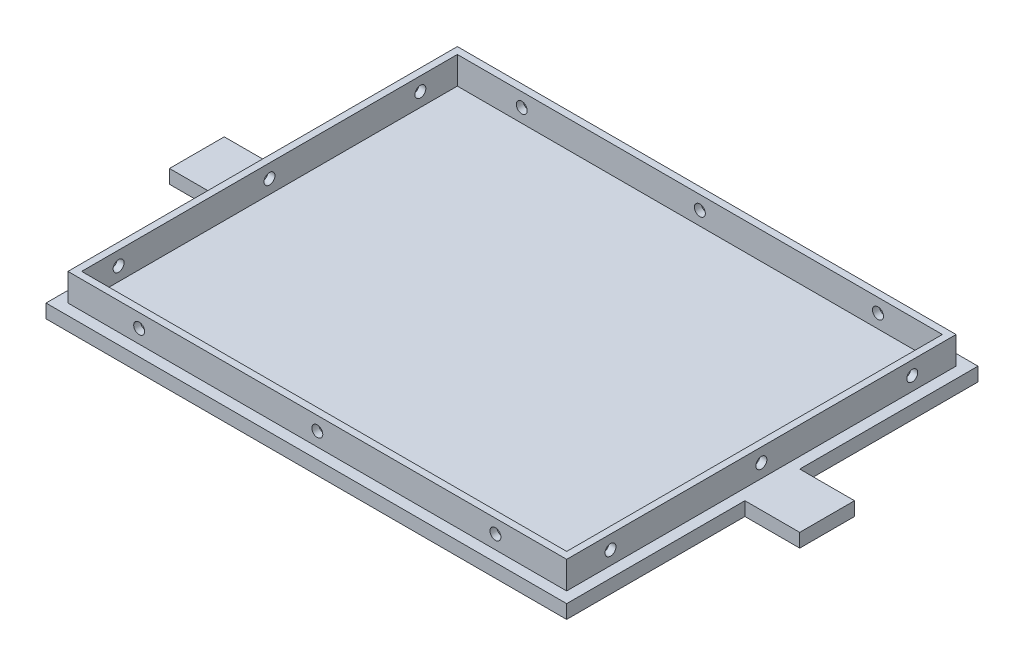
from build123d import *

# Parameters (mm, degrees)
BOSS_EXTRUDE1_DEPTH = 5
SKETCH3_W           = 182
SKETCH3_H           = 142.11
SKETCH3_W_2         = 177
SKETCH3_H_2         = 137.11
BOSS_EXTRUDE2_DEPTH = 10
SKETCH6_R           = 2
CUT_EXTRUDE3_DEPTH  = 211
SKETCH8_R           = 2
CUT_EXTRUDE4_DEPTH  = 211


with BuildPart() as part:
    # Sketch1 → Boss-Extrude1 (new body)
    with BuildSketch(Plane(origin=(0, 0, 0), x_dir=(1, 0, 0), z_dir=(0, 1, 0))):
        Polygon((-95, 75.055), (95, 75.055), (95, 10), (115, 10), (115, -10), (95, -10), (95, -75.055), (-95, -75.055), (-95, -10), (-115, -10), (-115, 10), (-95, 10), align=None)
    extrude(amount=BOSS_EXTRUDE1_DEPTH)

    # Sketch3 → Boss-Extrude2 (add)
    with BuildSketch(Plane(origin=(0, 5, 0), x_dir=(1, 0, 0), z_dir=(0, 1, 0))):
        Rectangle(SKETCH3_W, SKETCH3_H)
        Rectangle(SKETCH3_W_2, SKETCH3_H_2, mode=Mode.SUBTRACT)
    extrude(amount=BOSS_EXTRUDE2_DEPTH)

    # Sketch6 → Cut-Extrude3 (cut)
    with BuildSketch(Plane(origin=(0, 0, -75.055), x_dir=(-1, 0, 0), z_dir=(0, 0, -1))):
        with Locations((65, 10)):
            Circle(SKETCH6_R)
        with Locations((0, 10)):
            Circle(SKETCH6_R)
        with Locations((-65, 10)):
            Circle(SKETCH6_R)
    extrude(amount=-CUT_EXTRUDE3_DEPTH, mode=Mode.SUBTRACT)

    # Sketch8 → Cut-Extrude4 (cut)
    with BuildSketch(Plane.ZY.offset(95)):
        with Locations(Location((55.055, 10, 0), (0, 0, 180))):
            Circle(SKETCH8_R)
        with Locations(Location((0, 10, 0), (0, 0, 180))):
            Circle(SKETCH8_R)
        with Locations(Location((-55.055, 10, 0), (0, 0, 180))):
            Circle(SKETCH8_R)
    extrude(amount=-CUT_EXTRUDE4_DEPTH, mode=Mode.SUBTRACT)


solid = part.part
